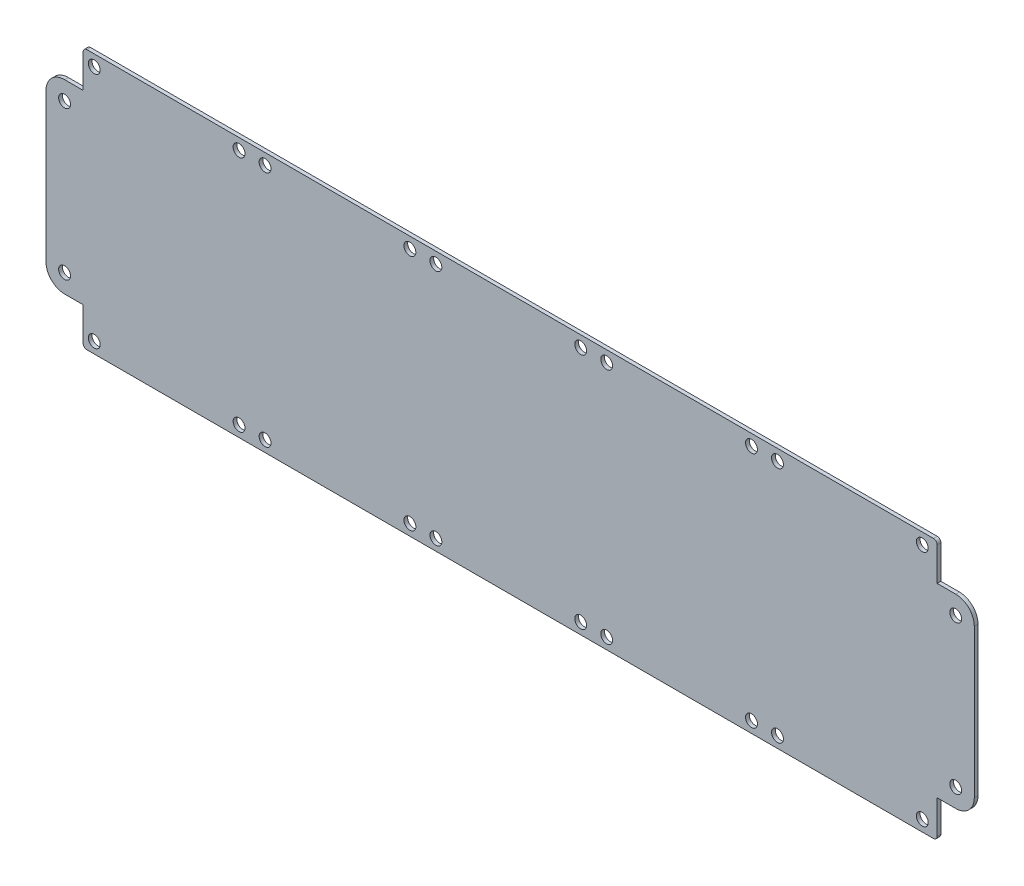
from build123d import *

# Parameters (mm, degrees)
SKETCH1_R           = 1.6
BOSS_EXTRUDE1_DEPTH = 1


with BuildPart() as part:
    # Sketch1 → Boss-Extrude1 (new body)
    with BuildSketch(Plane.XY):
        with BuildLine():
            Line((202.085666764, -21.015048426), (202.085666764, -30.015048426))
            ThreePointArc((202.085666764, -30.015048426), (201.792773545, -30.722155207), (201.085666764, -31.015048426))
            Line((201.085666764, -31.015048426), (-26.914333236, -31.015048426))
            ThreePointArc((-26.914333236, -31.015048426), (-27.621440018, -30.722155207), (-27.914333236, -30.015048426))
            Line((-27.914333236, -30.015048426), (-27.914333236, -21.015048426))
            Line((-27.914333236, -21.015048426), (-32.914333236, -21.015048426))
            ThreePointArc((-32.914333236, -21.015048426), (-36.449867142, -19.550582332), (-37.914333236, -16.015048426))
            Line((-37.914333236, -16.015048426), (-37.914333236, 23.984951574))
            ThreePointArc((-37.914333236, 23.984951574), (-36.449867142, 27.52048548), (-32.914333236, 28.984951574))
            Line((-32.914333236, 28.984951574), (-27.914333236, 28.984951574))
            Line((-27.914333236, 28.984951574), (-27.914333236, 37.984951574))
            ThreePointArc((-27.914333236, 37.984951574), (-27.621440018, 38.692058356), (-26.914333236, 38.984951574))
            Line((-26.914333236, 38.984951574), (201.085666764, 38.984951574))
            ThreePointArc((201.085666764, 38.984951574), (201.792773545, 38.692058356), (202.085666764, 37.984951574))
            Line((202.085666764, 37.984951574), (202.085666764, 28.984951574))
            Line((202.085666764, 28.984951574), (207.085666764, 28.984951574))
            ThreePointArc((207.085666764, 28.984951574), (210.62120067, 27.52048548), (212.085666764, 23.984951574))
            Line((212.085666764, 23.984951574), (212.085666764, -16.015048426))
            ThreePointArc((212.085666764, -16.015048426), (210.62120067, -19.550582332), (207.085666764, -21.015048426))
            Line((207.085666764, -21.015048426), (202.085666764, -21.015048426))
        make_face()
        with Locations((-24.914333236, 35.984951574)):
            Circle(SKETCH1_R, mode=Mode.SUBTRACT)
        with Locations((14.085666764, 35.984951574)):
            Circle(SKETCH1_R, mode=Mode.SUBTRACT)
        with Locations((-24.914333236, -28.015048426)):
            Circle(SKETCH1_R, mode=Mode.SUBTRACT)
        with Locations((14.085666764, -28.015048426)):
            Circle(SKETCH1_R, mode=Mode.SUBTRACT)
        with Locations((21.085666764, 35.984951574)):
            Circle(SKETCH1_R, mode=Mode.SUBTRACT)
        with Locations((60.085666764, 35.984951574)):
            Circle(SKETCH1_R, mode=Mode.SUBTRACT)
        with Locations((60.085666764, -28.015048426)):
            Circle(SKETCH1_R, mode=Mode.SUBTRACT)
        with Locations((21.085666764, -28.015048426)):
            Circle(SKETCH1_R, mode=Mode.SUBTRACT)
        with Locations((67.085666764, 35.984951574)):
            Circle(SKETCH1_R, mode=Mode.SUBTRACT)
        with Locations((106.085666764, 35.984951574)):
            Circle(SKETCH1_R, mode=Mode.SUBTRACT)
        with Locations((106.085666764, -28.015048426)):
            Circle(SKETCH1_R, mode=Mode.SUBTRACT)
        with Locations((67.085666764, -28.015048426)):
            Circle(SKETCH1_R, mode=Mode.SUBTRACT)
        with Locations((113.085666764, 35.984951574)):
            Circle(SKETCH1_R, mode=Mode.SUBTRACT)
        with Locations((152.085666764, 35.984951574)):
            Circle(SKETCH1_R, mode=Mode.SUBTRACT)
        with Locations((152.085666764, -28.015048426)):
            Circle(SKETCH1_R, mode=Mode.SUBTRACT)
        with Locations((113.085666764, -28.015048426)):
            Circle(SKETCH1_R, mode=Mode.SUBTRACT)
        with Locations((159.085666764, 35.984951574)):
            Circle(SKETCH1_R, mode=Mode.SUBTRACT)
        with Locations((198.085666764, 35.984951574)):
            Circle(SKETCH1_R, mode=Mode.SUBTRACT)
        with Locations((198.085666764, -28.015048426)):
            Circle(SKETCH1_R, mode=Mode.SUBTRACT)
        with Locations((159.085666764, -28.015048426)):
            Circle(SKETCH1_R, mode=Mode.SUBTRACT)
        with Locations((-32.914333236, -16.015048426)):
            Circle(SKETCH1_R, mode=Mode.SUBTRACT)
        with Locations((-32.914333236, 23.984951574)):
            Circle(SKETCH1_R, mode=Mode.SUBTRACT)
        with Locations((207.085666764, 23.984951574)):
            Circle(SKETCH1_R, mode=Mode.SUBTRACT)
        with Locations((207.085666764, -16.015048426)):
            Circle(SKETCH1_R, mode=Mode.SUBTRACT)
    extrude(amount=BOSS_EXTRUDE1_DEPTH)


solid = part.part
